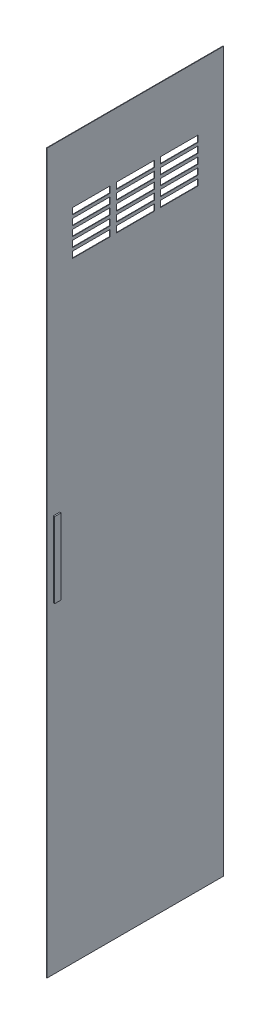
from build123d import *

# Parameters (mm, degrees)
SKETCH1_W           = 355.6
SKETCH1_H           = 1451.102
BOSS_EXTRUDE1_DEPTH = 0.999998
SKETCH2_W           = 76.45119902
SKETCH2_H           = 12.7
SKETCH2_W_2         = 76.70239804
CUT_EXTRUDE1_DEPTH  = 748.019473372
LPATTERN1_COUNT     = 5
LPATTERN1_PITCH     = 19.05
SKETCH3_W           = 12.7
SKETCH3_H           = 152.4
BOSS_EXTRUDE2_DEPTH = 2.54


with BuildPart() as part:
    # Sketch1 → Boss-Extrude1 (new body)
    with BuildSketch(Plane(origin=(0, 0, 0), x_dir=(0, 0, -1), z_dir=(1, 0, 0))):
        Rectangle(SKETCH1_W, SKETCH1_H)
    extrude(amount=BOSS_EXTRUDE1_DEPTH)

    # Sketch2 → Cut-Extrude1 (cut, through all)
    with BuildSketch(Plane(origin=(0.999998, 0, 0), x_dir=(0, 0, -1), z_dir=(1, 0, 0))):
        with Locations((-88.77440049, 589.382053571)):
            Rectangle(SKETCH2_W, SKETCH2_H)
        with Locations((0.12559951, 589.5101875)):
            Rectangle(SKETCH2_W_2, SKETCH2_H)
        with Locations((88.9, 589.5101875)):
            Rectangle(SKETCH2_W, SKETCH2_H)
    cut_extrude1 = extrude(amount=-CUT_EXTRUDE1_DEPTH, mode=Mode.SUBTRACT)

    # LPattern1: Cut-Extrude1 ×5
    with Locations(*[(0, -i * LPATTERN1_PITCH, 0) for i in range(1, LPATTERN1_COUNT)]):
        add(cut_extrude1, mode=Mode.SUBTRACT)

    # Sketch3 → Boss-Extrude2 (add)
    with BuildSketch(Plane(origin=(0.999998, 0, 0), x_dir=(0, 0, -1), z_dir=(1, 0, 0))):
        with Locations((-158.75, 0)):
            Rectangle(SKETCH3_W, SKETCH3_H)
    extrude(amount=BOSS_EXTRUDE2_DEPTH)


solid = part.part
